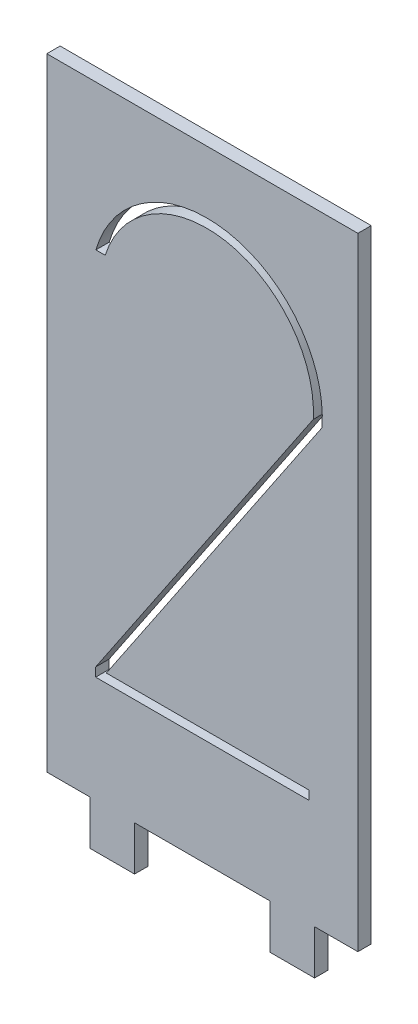
from build123d import *

# Parameters (mm, degrees)
SKIZZE1_W                        = 35
SKIZZE1_H                        = 75
AUFSATZ_LINEAR_AUSTRAGEN1_DEPTH  = 1.5
SKIZZE3_W                        = 15.25
SKIZZE3_H                        = 5
SKIZZE3_W_2                      = 4.875
SCHNITT_LINEAR_AUSTRAGEN12_DEPTH = 20
SCHNITT_LINEAR_AUSTRAGEN14_DEPTH = 1.5


with BuildPart() as part:
    # Skizze1 → Aufsatz-Linear austragen1 (new body)
    with BuildSketch(Plane.XY):
        with Locations((17.5, 37.5)):
            Rectangle(SKIZZE1_W, SKIZZE1_H)
    extrude(amount=AUFSATZ_LINEAR_AUSTRAGEN1_DEPTH)

    # Skizze3 → Schnitt-Linear austragen12 (cut)
    with BuildSketch(Plane.XY.offset(1.5)):
        with Locations((17.5, 2.5)):
            Rectangle(SKIZZE3_W, SKIZZE3_H)
        with Locations((32.5625, 2.5)):
            Rectangle(SKIZZE3_W_2, SKIZZE3_H)
        with Locations((2.4375, 2.5)):
            Rectangle(SKIZZE3_W_2, SKIZZE3_H)
    extrude(amount=-SCHNITT_LINEAR_AUSTRAGEN12_DEPTH, mode=Mode.SUBTRACT)

    # Skizze7 → Schnitt-Linear austragen14 (cut)
    with BuildSketch(Plane.XY.offset(1.5)):
        with BuildLine():
            Line((29.982770168, 54.357178796), (5.5, 18))
            Line((5.5, 18), (5.5, 17))
            Line((5.5, 17), (29.5, 17))
            Line((29.5, 17), (29.5, 18))
            Line((29.5, 18), (6.7, 18))
            Line((6.7, 18), (30.963924784, 54.032191031))
            ThreePointArc((30.963924784, 54.032191031), (20.317920223, 67.791686591), (5.520765623, 58.642623967))
            Line((5.520765623, 58.642623967), (6.566221507, 58.642623967))
            ThreePointArc((6.566221507, 58.642623967), (20.16023333, 66.803956623), (29.982770168, 54.357178796))
        make_face()
    extrude(amount=-SCHNITT_LINEAR_AUSTRAGEN14_DEPTH, mode=Mode.SUBTRACT)


solid = part.part
